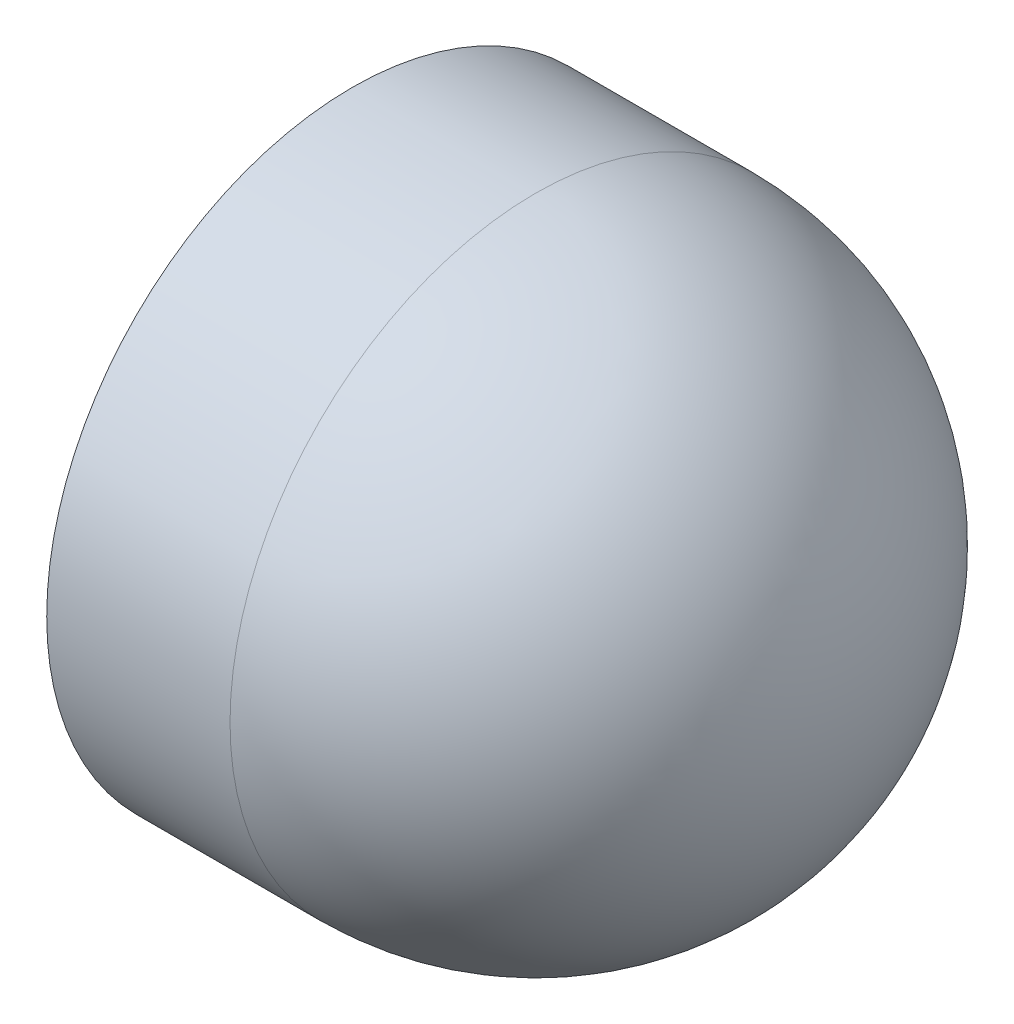
from build123d import *

# Parameters (mm, degrees)
CUT_EXTRUDE1_DEPTH = 2.75
SKETCH3_R          = 1.127
CUT_EXTRUDE2_DEPTH = 2.1


with BuildPart() as part:
    # Sketch1 → Revolve1 (revolve)
    with BuildSketch(Plane.XY, mode=Mode.PRIVATE) as revolve1_sk:
        with BuildLine():
            Line((0, 0), (12, 0))
            ThreePointArc((12, 0), (9.803300859, -5.303300859), (4.5, -7.5))
            Line((4.5, -7.5), (0, -7.5))
            Line((0, -7.5), (0, 0))
        make_face()
    revolve(revolve1_sk.sketch.rotate(Axis((0, 0, 0), (1, 0, 0)), 270), axis=Axis((0, 0, 0), (1, 0, 0)))

    # Sketch2 → Cut-Extrude1 (cut)
    with BuildSketch(Plane.ZY):
        Polygon((2.050748156, 3.552), (-2.050748156, 3.552), (-4.101496312, 0), (-2.050748156, -3.552), (2.050748156, -3.552), (4.101496312, 0), align=None)
    extrude(amount=-CUT_EXTRUDE1_DEPTH, mode=Mode.SUBTRACT)

    # Sketch3 → Cut-Extrude2 (cut)
    with BuildSketch(Plane.ZY):
        with Locations((-4.763139721, -2.75)):
            Circle(SKETCH3_R)
        with Locations((0, 5.5)):
            Circle(SKETCH3_R)
        with Locations((4.763139721, -2.75)):
            Circle(SKETCH3_R)
    extrude(amount=-CUT_EXTRUDE2_DEPTH, mode=Mode.SUBTRACT)


solid = part.part
